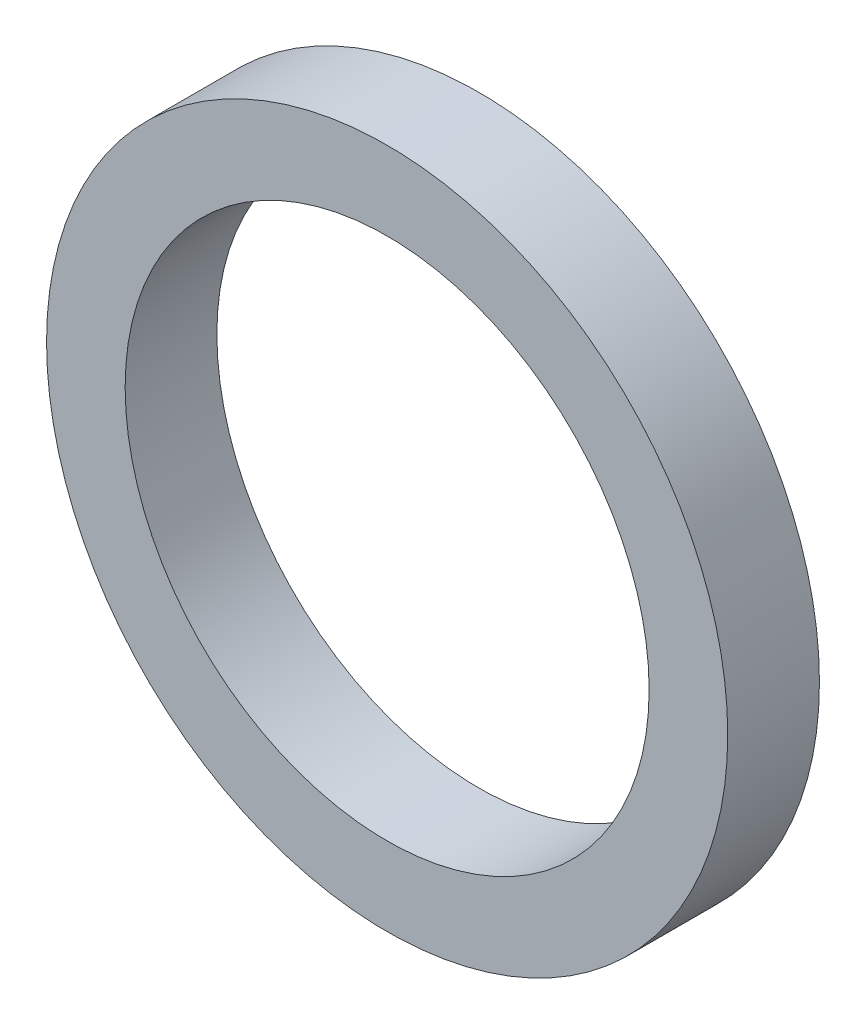
from build123d import *

# Parameters (mm, degrees)
S01_ANNULAR_SECTION_R      = 26
S01_ANNULAR_SECTION_R_2    = 20
F_01_ANNULAR_SECTION_DEPTH = 7


with BuildPart() as part:
    # S01 - Annular section → 01 - Annular section (new body)
    with BuildSketch(Plane.XY):
        Circle(S01_ANNULAR_SECTION_R)
        Circle(S01_ANNULAR_SECTION_R_2, mode=Mode.SUBTRACT)
    extrude(amount=F_01_ANNULAR_SECTION_DEPTH)


solid = part.part
